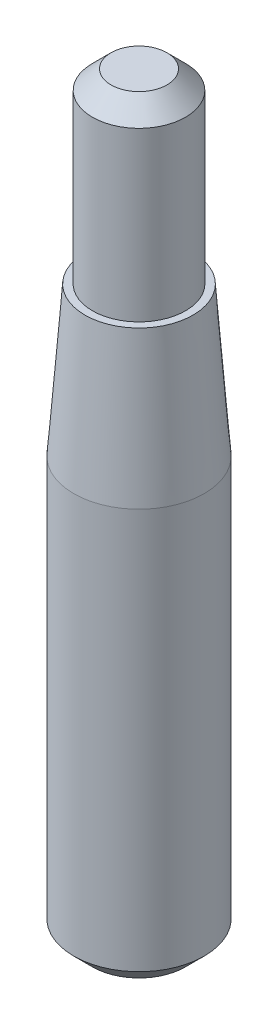
from build123d import *

# Parameters (mm, degrees)
SKETCH2_R           = 7
BOSS_EXTRUDE1_DEPTH = 45
SKETCH3_R           = 7
BOSS_EXTRUDE2_DEPTH = 16
BOSS_EXTRUDE2_TAPER = 4.289
SKETCH4_R           = 5
BOSS_EXTRUDE3_DEPTH = 20
CHAMFER1_SIZE       = 2


with BuildPart() as part:
    # Sketch2 → Boss-Extrude1 (new body)
    with BuildSketch(Plane(origin=(0, 0, 0), x_dir=(1, 0, 0), z_dir=(0, 1, 0))):
        with Locations(Location((0, 0, 0), (0, 0, 90))):
            Circle(SKETCH2_R)
    extrude(amount=BOSS_EXTRUDE1_DEPTH)

    # Sketch3 → Boss-Extrude2 (add)
    with BuildSketch(Plane(origin=(0, 45, 0), x_dir=(1, 0, 0), z_dir=(0, 1, 0))):
        with Locations(Location((0, 0, 0), (0, 0, 90))):
            Circle(SKETCH3_R)
    extrude(amount=BOSS_EXTRUDE2_DEPTH, taper=BOSS_EXTRUDE2_TAPER)

    # Sketch4 → Boss-Extrude3 (add)
    with BuildSketch(Plane(origin=(0, 61, 0), x_dir=(1, 0, 0), z_dir=(0, 1, 0))):
        with Locations(Location((0, 0, 0), (0, 0, 270))):
            Circle(SKETCH4_R)
    extrude(amount=BOSS_EXTRUDE3_DEPTH)

    # Chamfer1
    chamfer1_edges = [part.edges().sort_by_distance(p)[0] for p in [
        (0, 0, 7),
        (0, 81, -5),
    ]]
    chamfer(chamfer1_edges, length=CHAMFER1_SIZE)


solid = part.part
